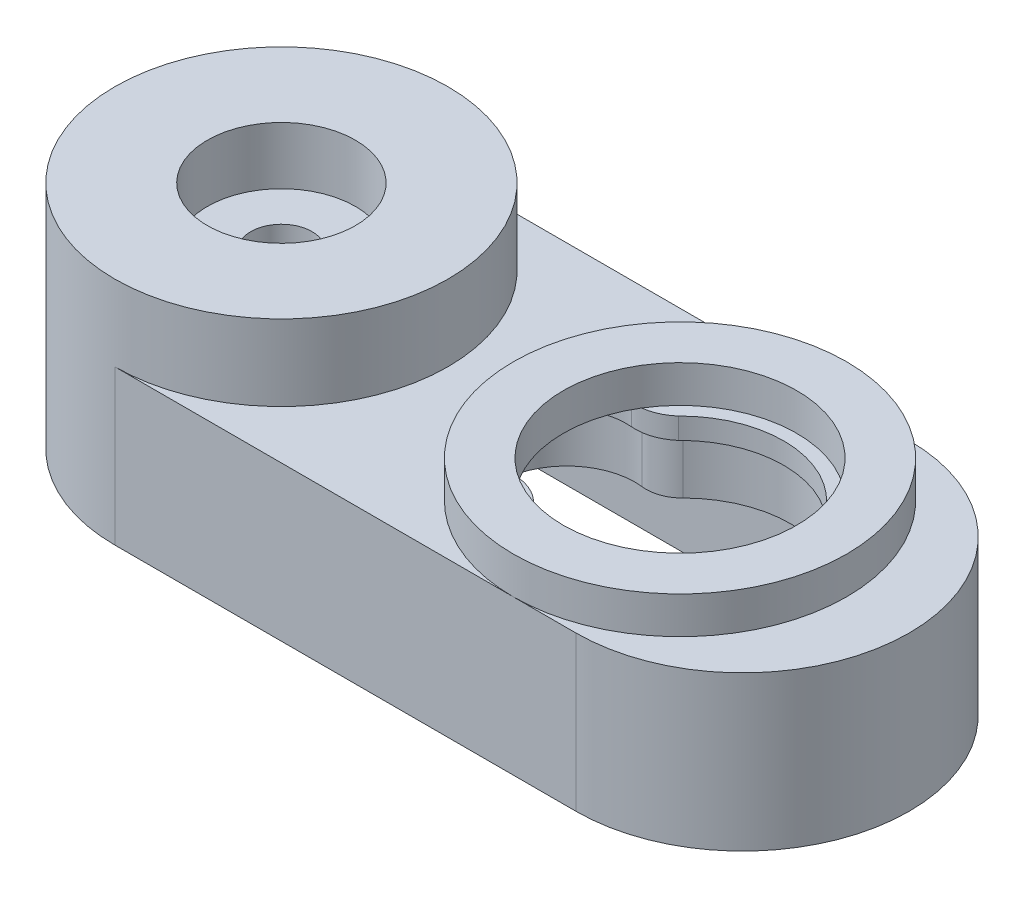
from build123d import *

# Parameters (mm, degrees)
SKETCH_1_W          = 23.6
SKETCH_1_H          = 12
EXTRUDE_1_DEPTH     = 1.14
SKETCH_2_W          = 23.6
SKETCH_2_H          = 12
EXTRUDE_2_DEPTH     = 3.2
CUT_EXTRUDE_1_DEPTH = 18.380322206
EXTRUDE_3_DEPTH     = 3
EXTRUDE_4_DEPTH     = 3
EXTRUDE_START       = -8.34
SKETCH_6_W          = 4.5
SKETCH_6_H          = 18
EXTRUDE_6_DEPTH     = 6
SKETCH_9_W          = 18
SKETCH_9_H          = 6
EXTRUDE_8_DEPTH     = 4
SKETCH_11_W         = 8.5
SKETCH_11_H         = 18
EXTRUDE_11_DEPTH    = 2.34
SKETCH_13_W         = 18
SKETCH_13_H         = 6
EXTRUDE_12_DEPTH    = 2
SKETCH_14_W         = 18
SKETCH_14_H         = 8.34
EXTRUDE_13_DEPTH    = 8
SKETCH_15_W         = 6.5
SKETCH_15_H         = 18
EXTRUDE_14_DEPTH    = 2.34
SKETCH_12_R         = 1.65
CUT_EXTRUDE_2_DEPTH = 8.34
SKETCH_16_R         = 3
CUT_EXTRUDE_3_DEPTH = 3
SKETCH_17_R         = 9
SKETCH_17_R_2       = 6.303921286
EXTRUDE_15_DEPTH    = 2
SKETCH_18_R         = 9
EXTRUDE_16_DEPTH    = 1
CUT_EXTRUDE_START   = -10
SKETCH_19_R         = 1.65
CUT_EXTRUDE_4_DEPTH = 10
CUT_EXTRUDE_START_2 = -8.34
CUT_EXTRUDE_5_DEPTH = 8.34
CUT_EXTRUDE_6_DEPTH = 8.34
SKETCH_23_R         = 9
SKETCH_23_R_2       = 4
EXTRUDE_17_DEPTH    = 3.1


with BuildPart() as part:
    # 草图1 → 凸台-拉伸1 (new body)
    with BuildSketch(Plane(origin=(0, 0, 0), x_dir=(1, 0, 0), z_dir=(0, 1, 0))):
        Rectangle(SKETCH_1_W, SKETCH_1_H)
        with BuildLine():
            ThreePointArc((0.007454552, 3.287456445), (-3.58, 0), (0.007454552, -3.287456445))
            ThreePointArc((0.007454552, -3.287456445), (1.025918755, -3.405297551), (1.915651286, -3.91474027))
            ThreePointArc((1.915651286, -3.91474027), (11.52, 0), (1.915651286, 3.91474027))
            ThreePointArc((1.915651286, 3.91474027), (1.025918755, 3.405297551), (0.007454552, 3.287456445))
        make_face(mode=Mode.SUBTRACT)
    extrude(amount=-EXTRUDE_1_DEPTH)

    # 草图2 → 凸台-拉伸2 (add)
    with BuildSketch(Plane.XZ.offset(1.14)):
        Rectangle(SKETCH_2_W, SKETCH_2_H)
        with BuildLine():
            ThreePointArc((1.858985772, -4.210779433), (11.77, 0), (1.858985772, 4.210779433))
            ThreePointArc((1.858985772, 4.210779433), (1.095204485, 3.750394966), (0.20723472, 3.667778937))
            ThreePointArc((0.20723472, 3.667778937), (-3.98, 0), (0.20723472, -3.667778937))
            ThreePointArc((0.20723472, -3.667778937), (1.095204485, -3.750394966), (1.858985772, -4.210779433))
        make_face(mode=Mode.SUBTRACT)
    extrude(amount=EXTRUDE_2_DEPTH)

    # 草图3 → 切除-拉伸1 (cut, through all)
    with BuildSketch(Plane.XY.offset(6)):
        Polygon((-10.893933983, -4.233933983), (-11, -4.34), (11.220943823, -4.34), (11.220943823, -4.171669574), (10.902745772, -3.853471522), align=None)
    extrude(amount=-CUT_EXTRUDE_1_DEPTH, mode=Mode.SUBTRACT)

    # 草图4 → 凸台-拉伸3 (add)
    with BuildSketch(Plane.XY.offset(6)):
        Polygon((-11.8, -4.34), (-11.8, -8.34), (11.8, -8.34), (11.8, -4.34), (11.8, 0), (-11.8, 0), align=None)
    extrude(amount=EXTRUDE_3_DEPTH)

    # 草图5 → 凸台-拉伸4 (add)
    with BuildSketch(Plane(origin=(0, 0, -6), x_dir=(-1, 0, 0), z_dir=(0, 0, -1))):
        Polygon((11.8, -8.34), (-11.8, -8.34), (-11.8, -4.34), (-11.8, 0), (11.8, 0), (11.8, -4.34), align=None)
    extrude(amount=EXTRUDE_4_DEPTH)

    # 草图6 → 凸台-拉伸6 (add)
    with BuildSketch(Plane(origin=(0, 0, 0), x_dir=(1, 0, 0), z_dir=(0, 1, 0)).offset(EXTRUDE_START)):
        with Locations((14.05, 0)):
            Rectangle(SKETCH_6_W, SKETCH_6_H)
        with Locations((-14.05, 0)):
            Rectangle(SKETCH_6_W, SKETCH_6_H)
    extrude(amount=EXTRUDE_6_DEPTH)

    # 草图9 → 凸台-拉伸8 (add)
    with BuildSketch(Plane.ZY.offset(16.3)):
        with Locations((0, -5.34)):
            Rectangle(SKETCH_9_W, SKETCH_9_H)
    extrude(amount=EXTRUDE_8_DEPTH)

    # 草图11 → 凸台-拉伸11 (add)
    with BuildSketch(Plane(origin=(0, -2.34, 0), x_dir=(1, 0, 0), z_dir=(0, 1, 0))):
        with Locations((-16.05, 0)):
            Rectangle(SKETCH_11_W, SKETCH_11_H)
    extrude(amount=EXTRUDE_11_DEPTH)

    # 草图13 → 凸台-拉伸12 (add)
    with BuildSketch(Plane(origin=(16.3, 0, 0), x_dir=(0, 0, -1), z_dir=(1, 0, 0))):
        with Locations((0, -5.34)):
            Rectangle(SKETCH_13_W, SKETCH_13_H)
    extrude(amount=EXTRUDE_12_DEPTH)

    # 草图14 → 凸台-拉伸13 (add)
    with BuildSketch(Plane.ZY.offset(20.3)):
        with Locations((0, -4.17)):
            Rectangle(SKETCH_14_W, SKETCH_14_H)
    extrude(amount=EXTRUDE_13_DEPTH)

    # 草图15 → 凸台-拉伸14 (add)
    with BuildSketch(Plane(origin=(0, -2.34, 0), x_dir=(1, 0, 0), z_dir=(0, 1, 0))):
        with Locations((15.05, 0)):
            Rectangle(SKETCH_15_W, SKETCH_15_H)
    extrude(amount=EXTRUDE_14_DEPTH)

    # 草图12 → 切除-拉伸2 (cut)
    with BuildSketch(Plane(origin=(0, 0, 0), x_dir=(1, 0, 0), z_dir=(0, 1, 0))):
        with Locations(Location((-15.61, 0, 0), (0, 0, 270))):
            Circle(SKETCH_12_R)
    extrude(amount=-CUT_EXTRUDE_2_DEPTH, mode=Mode.SUBTRACT)

    # 草图16 → 切除-拉伸3 (cut)
    with BuildSketch(Plane.XZ.offset(8.34)):
        with Locations(Location((-15.61, 0, 0), (0, 0, 270))):
            Circle(SKETCH_16_R)
    extrude(amount=-CUT_EXTRUDE_3_DEPTH, mode=Mode.SUBTRACT)

    # 草图17 → 凸台-拉伸15 (add)
    with BuildSketch(Plane(origin=(0, 0, 0), x_dir=(1, 0, 0), z_dir=(0, 1, 0))):
        with Locations(Location((5.92, 0, 0), (0, 0, 270))):
            Circle(SKETCH_17_R)
        with Locations(Location((5.92, 0, 0), (0, 0, 148.458888043))):
            Circle(SKETCH_17_R_2, mode=Mode.SUBTRACT)
    extrude(amount=EXTRUDE_15_DEPTH)

    # 草图18 → 凸台-拉伸16 (add)
    with BuildSketch(Plane(origin=(0, 0, 0), x_dir=(1, 0, 0), z_dir=(0, 1, 0))):
        with Locations(Location((-15.61, 0, 0), (0, 0, 270))):
            Circle(SKETCH_18_R)
    extrude(amount=EXTRUDE_16_DEPTH)

    # 草图19 → 切除-拉伸4 (cut)
    with BuildSketch(Plane.XZ.offset(CUT_EXTRUDE_START)):
        with Locations(Location((-15.61, 0, 0), (0, 0, 90))):
            Circle(SKETCH_19_R)
    extrude(amount=CUT_EXTRUDE_4_DEPTH, mode=Mode.SUBTRACT)

    # 草图20 → 切除-拉伸5 (cut)
    with BuildSketch(Plane(origin=(0, 0, 0), x_dir=(1, 0, 0), z_dir=(0, 1, 0)).offset(CUT_EXTRUDE_START_2)):
        with BuildLine():
            Line((-15.61, -9), (-28.3, -9))
            Line((-28.3, -9), (-28.3, 9))
            Line((-28.3, 9), (-15.61, 9))
            ThreePointArc((-15.61, 9), (-24.61, 0), (-15.61, -9))
        make_face()
    extrude(amount=CUT_EXTRUDE_5_DEPTH, mode=Mode.SUBTRACT)

    # 草图21 → 切除-拉伸6 (cut)
    with BuildSketch(Plane(origin=(0, 0, 0), x_dir=(1, 0, 0), z_dir=(0, 1, 0))):
        with BuildLine():
            ThreePointArc((9.3, 9), (15.663961016, 6.363961045), (18.3, 4.1e-08))
            Line((18.3, 4.1e-08), (18.3, 9))
            Line((18.3, 9), (12.11, 9))
            Line((12.11, 9), (9.3, 9))
        make_face()
        with BuildLine():
            ThreePointArc((18.3, 4.1e-08), (15.663961045, -6.363961016), (9.3, -9))
            Line((9.3, -9), (18.3, -9))
            Line((18.3, -9), (18.3, 4.1e-08))
        make_face()
    extrude(amount=-CUT_EXTRUDE_6_DEPTH, mode=Mode.SUBTRACT)

    # 草图23 → 凸台-拉伸17 (add)
    with BuildSketch(Plane(origin=(0, 1, 0), x_dir=(1, 0, 0), z_dir=(0, 1, 0))):
        with Locations(Location((-15.61, 0, 0), (0, 0, 270))):
            Circle(SKETCH_23_R)
        with Locations(Location((-15.61, 0, 0), (0, 0, 90))):
            Circle(SKETCH_23_R_2, mode=Mode.SUBTRACT)
    extrude(amount=EXTRUDE_17_DEPTH)


solid = part.part
